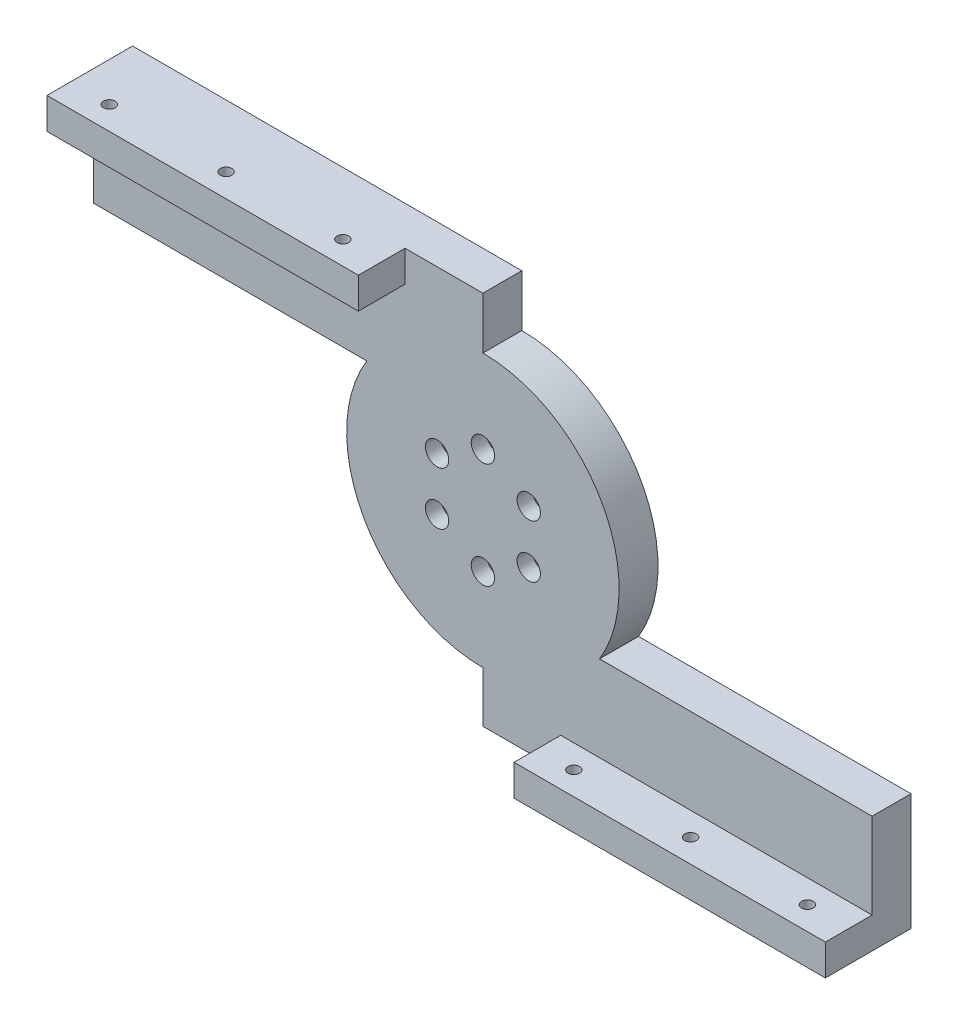
from build123d import *

# Parameters (mm, degrees)
SKETCH1_R           = 35
SKETCH1_W           = 100
SKETCH1_H           = 30
BOSS_EXTRUDE2_DEPTH = 10
SKETCH2_R           = 3
SKETCH2_R_2         = 1.5
CUT_EXTRUDE2_DEPTH  = 4
SKETCH3_R           = 1.5
CUT_EXTRUDE3_DEPTH  = 112.510800428
SKETCH5_W           = 80
SKETCH5_H           = 8
BOSS_EXTRUDE3_DEPTH = 12
SKETCH6_R           = 1.5
CUT_EXTRUDE4_DEPTH  = 136.260863051
SKETCH7_R           = 1.5
CUT_EXTRUDE5_DEPTH  = 136.260863051


with BuildPart() as part:
    # Sketch1 → Boss-Extrude2 (new body)
    with BuildSketch(Plane.XY):
        Circle(SKETCH1_R)
        with Locations((50, -33.064391539)):
            Rectangle(SKETCH1_W, SKETCH1_H)
        with Locations((-50, 33.318305145)):
            Rectangle(SKETCH1_W, SKETCH1_H)
    extrude(amount=BOSS_EXTRUDE2_DEPTH)

    # Sketch2 → Cut-Extrude2 (cut)
    # profile 1 of 6: a face of its own
    with BuildSketch(Plane.XY.offset(10)):
        with Locations((0, -13.598895475)):
            Circle(SKETCH2_R)
        with Locations((0, -13.598895475)):
            Circle(SKETCH2_R_2, mode=Mode.SUBTRACT)
    # profile 2 of 6: a face of its own
    with BuildSketch(Plane.XY.offset(10)):
        with Locations((-11.776988944, -6.799447737)):
            Circle(SKETCH2_R)
        with Locations((-11.776988944, -6.799447737)):
            Circle(SKETCH2_R_2, mode=Mode.SUBTRACT)
    # profile 3 of 6: a face of its own
    with BuildSketch(Plane.XY.offset(10)):
        with Locations((-11.776988944, 6.799447737)):
            Circle(SKETCH2_R)
        with Locations((-11.776988944, 6.799447737)):
            Circle(SKETCH2_R_2, mode=Mode.SUBTRACT)
    # profile 4 of 6: a face of its own
    with BuildSketch(Plane.XY.offset(10)):
        with Locations((0, 13.598895475)):
            Circle(SKETCH2_R)
        with Locations((0, 13.598895475)):
            Circle(SKETCH2_R_2, mode=Mode.SUBTRACT)
    # profile 5 of 6: a face of its own
    with BuildSketch(Plane.XY.offset(10)):
        with Locations((11.776988944, 6.799447737)):
            Circle(SKETCH2_R)
        with Locations((11.776988944, 6.799447737)):
            Circle(SKETCH2_R_2, mode=Mode.SUBTRACT)
    # profile 6 of 6: a face of its own
    with BuildSketch(Plane.XY.offset(10)):
        with Locations((11.776988944, -6.799447737)):
            Circle(SKETCH2_R)
        with Locations((11.776988944, -6.799447737)):
            Circle(SKETCH2_R_2, mode=Mode.SUBTRACT)
    extrude(amount=-CUT_EXTRUDE2_DEPTH, mode=Mode.SUBTRACT)

    # Sketch3 → Cut-Extrude3 (cut, through all)
    with BuildSketch(Plane.XY.offset(10)):
        with Locations((0, -13.598895475)):
            Circle(SKETCH3_R)
        with Locations((-11.776988944, -6.799447737)):
            Circle(SKETCH3_R)
        with Locations((-11.776988944, 6.799447737)):
            Circle(SKETCH3_R)
        with Locations((0, 13.598895475)):
            Circle(SKETCH3_R)
        with Locations((11.776988944, 6.799447737)):
            Circle(SKETCH3_R)
        with Locations((11.776988944, -6.799447737)):
            Circle(SKETCH3_R)
    extrude(amount=-CUT_EXTRUDE3_DEPTH, mode=Mode.SUBTRACT)

    # Sketch5 → Boss-Extrude3 (add)
    with BuildSketch(Plane.XY.offset(10)):
        with Locations((-60, 44.318305145)):
            Rectangle(SKETCH5_W, SKETCH5_H)
        with Locations((60, -44.064391539)):
            Rectangle(SKETCH5_W, SKETCH5_H)
    extrude(amount=BOSS_EXTRUDE3_DEPTH)

    # Sketch6 → Cut-Extrude4 (cut, through all)
    with BuildSketch(Plane(origin=(0, 40.318305145, 0), x_dir=(-1, 0, 0), z_dir=(0, -1, 0))):
        with Locations(Location((89.985573023, -16, 0), (0, 0, 90))):
            Circle(SKETCH6_R)
        with Locations(Location((59.985573023, -16, 0), (0, 0, 90))):
            Circle(SKETCH6_R)
        with Locations(Location((29.985573023, -16, 0), (0, 0, 90))):
            Circle(SKETCH6_R)
    extrude(amount=-CUT_EXTRUDE4_DEPTH, mode=Mode.SUBTRACT)

    # Sketch7 → Cut-Extrude5 (cut, through all)
    with BuildSketch(Plane(origin=(0, -40.064391539, 0), x_dir=(1, 0, 0), z_dir=(0, 1, 0))):
        with Locations(Location((29.372536894, -16, 0), (0, 0, 180))):
            Circle(SKETCH7_R)
        with Locations(Location((59.372536894, -16, 0), (0, 0, 180))):
            Circle(SKETCH7_R)
        with Locations(Location((89.372536894, -16, 0), (0, 0, 180))):
            Circle(SKETCH7_R)
    extrude(amount=-CUT_EXTRUDE5_DEPTH, mode=Mode.SUBTRACT)


solid = part.part
